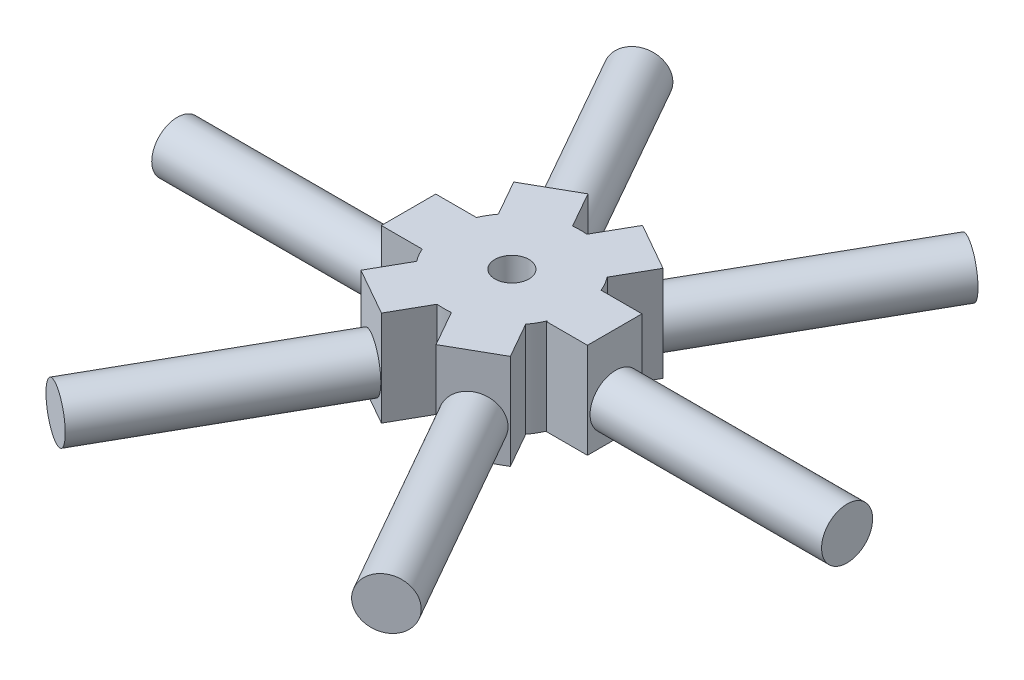
from build123d import *

# Parameters (mm, degrees)
SKETCH1_R                = 12.7
SKETCH1_R_2              = 3.175
BOSS_EXTRUDE1_DEPTH      = 22.86
SKETCH4_W                = 7.62
SKETCH4_H                = 10.16
BOSS_EXTRUDE2_DEPTH      = 22.86
CUT_EXTRUDE1_DEPTH       = 51.830375937
CUT_EXTRUDE1_DEPTH_BACK  = 51.830375937
SKETCH8_R                = 3
CUT_EXTRUDE2_DEPTH       = 54.699688086
CUT_EXTRUDE2_DEPTH_BACK  = 54.699688086
SKETCH9_R                = 3
CUT_EXTRUDE3_DEPTH       = 54.699688086
CUT_EXTRUDE3_DEPTH_BACK  = 54.699688086
SKETCH10_R               = 3
SKETCH12_R               = 23.401643017
CUT_EXTRUDE4_DEPTH       = 5.08
BOSS_EXTRUDE3_DEPTH      = 40.64
BOSS_EXTRUDE3_DEPTH_BACK = 2.54
SKETCH14_R               = 4.7625
BOSS_EXTRUDE4_DEPTH      = 40.64
BOSS_EXTRUDE4_DEPTH_BACK = 2.54
SKETCH15_R               = 4.7625
BOSS_EXTRUDE5_DEPTH      = 40.64
BOSS_EXTRUDE5_DEPTH_BACK = 2.54
SKETCH16_R               = 4.7625
BOSS_EXTRUDE6_DEPTH      = 40.64
BOSS_EXTRUDE6_DEPTH_BACK = 2.54
SKETCH17_R               = 4.7625
SKETCH18_R               = 4.7625
BOSS_EXTRUDE7_DEPTH      = 43.18
SKETCH19_R               = 4.7625
BOSS_EXTRUDE8_DEPTH      = 43.18


with BuildPart() as part:
    # Sketch1 → Boss-Extrude1 (new body)
    with BuildSketch(Plane(origin=(0, 0, 0), x_dir=(1, 0, 0), z_dir=(0, 1, 0))):
        with Locations(Location((0, 0, 0), (0, 0, 270))):
            Circle(SKETCH1_R)
        with Locations(Location((0, 0, 0), (0, 0, 270))):
            Circle(SKETCH1_R_2, mode=Mode.SUBTRACT)
    extrude(amount=BOSS_EXTRUDE1_DEPTH)

    # Sketch4 → Boss-Extrude2 (add)
    with BuildSketch(Plane(origin=(0, 0, 0), x_dir=(1, 0, 0), z_dir=(0, 1, 0))):
        with Locations((15.520261251, -0.164739944)):
            Rectangle(SKETCH4_W, SKETCH4_H)
        with Locations((-15.431900524, -0.040686304)):
            Rectangle(SKETCH4_W, SKETCH4_H)
        Polygon((-13.918276287, 14.248707215), (-10.16, 7.62), (-1.321723713, 12.63103505), (-5.08, 19.259742265), align=None)
        Polygon((5.105090281, 19.253106901), (1.338180271, 12.62930218), (10.169919899, 7.606755501), (13.936829909, 14.230560221), align=None)
        Polygon((-1.321723713, -12.63103505), (-10.16, -7.62), (-13.918276287, -14.248707215), (-5.08, -19.259742265), align=None)
        Polygon((10.169919899, -7.606755501), (1.338180271, -12.62930218), (5.105090281, -19.253106901), (13.936829909, -14.230560221), align=None)
    extrude(amount=BOSS_EXTRUDE2_DEPTH)

    # Sketch8 → Cut-Extrude1 (cut, two sides: drawn at the far end of the back side and taken through both)
    with BuildSketch(Plane.ZY.offset(21.781900524).offset(-CUT_EXTRUDE1_DEPTH_BACK)):
        with Locations((0, 11.43)):
            Circle(SKETCH8_R)
    extrude(amount=CUT_EXTRUDE1_DEPTH + CUT_EXTRUDE1_DEPTH_BACK, mode=Mode.SUBTRACT)

    # Sketch9 → Cut-Extrude2 (cut, two sides: drawn at the far end of the back side and taken through both)
    with BuildSketch(Plane(origin=(10.776596765, 0, -18.949768468), x_dir=(-0.8692657113802013, 0, -0.49434514564084964), z_dir=(0.49434514564084964, 0, -0.8692657113802013)).offset(-CUT_EXTRUDE2_DEPTH_BACK)):
        with Locations(Location((0, 11.43, 0), (0, 0, 180))):
            Circle(SKETCH9_R)
    extrude(amount=CUT_EXTRUDE2_DEPTH + CUT_EXTRUDE2_DEPTH_BACK, mode=Mode.SUBTRACT)

    # Sketch10 → Cut-Extrude3 (cut, two sides: drawn at the far end of the back side and taken through both)
    with BuildSketch(Plane(origin=(10.776596765, 0, 18.949768468), x_dir=(0.8692657113802004, 0, -0.494345145640851), z_dir=(0.494345145640851, 0, 0.8692657113802004)).offset(-CUT_EXTRUDE3_DEPTH_BACK)):
        with Locations((0, 11.43)):
            Circle(SKETCH10_R)
    extrude(amount=CUT_EXTRUDE3_DEPTH + CUT_EXTRUDE3_DEPTH_BACK, mode=Mode.SUBTRACT)

    # Sketch12 → Cut-Extrude4 (cut)
    with BuildSketch(Plane(origin=(0, 0, 0), x_dir=(1, 0, 0), z_dir=(0, 1, 0))):
        Circle(SKETCH12_R)
    extrude(amount=CUT_EXTRUDE4_DEPTH, mode=Mode.SUBTRACT)

    # Sketch14 → Boss-Extrude3 (add, two sides: drawn at the far end of the back side and taken through both)
    with BuildSketch(Plane(origin=(21.870261251, 0, 0), x_dir=(0, 0, -1), z_dir=(1, 0, 0)).offset(-BOSS_EXTRUDE3_DEPTH_BACK)):
        with Locations((0, 11.43)):
            Circle(SKETCH14_R)
    extrude(amount=BOSS_EXTRUDE3_DEPTH + BOSS_EXTRUDE3_DEPTH_BACK)

    # Sketch15 → Boss-Extrude4 (add, two sides: drawn at the far end of the back side and taken through both)
    with BuildSketch(Plane(origin=(10.776596765, 0, 18.949768468), x_dir=(0.8692657113802004, 0, -0.494345145640851), z_dir=(0.494345145640851, 0, 0.8692657113802004)).offset(-BOSS_EXTRUDE4_DEPTH_BACK)):
        with Locations((0, 11.43)):
            Circle(SKETCH15_R)
    extrude(amount=BOSS_EXTRUDE4_DEPTH + BOSS_EXTRUDE4_DEPTH_BACK)

    # Sketch16 → Boss-Extrude5 (add, two sides: drawn at the far end of the back side and taken through both)
    with BuildSketch(Plane.ZY.offset(21.781900524).offset(-BOSS_EXTRUDE5_DEPTH_BACK)):
        with Locations(Location((0, 11.43, 0), (0, 0, 180))):
            Circle(SKETCH16_R)
    extrude(amount=BOSS_EXTRUDE5_DEPTH + BOSS_EXTRUDE5_DEPTH_BACK)

    # Sketch17 → Boss-Extrude6 (add, two sides: drawn at the far end of the back side and taken through both)
    with BuildSketch(Plane(origin=(10.776596765, 0, -18.949768468), x_dir=(-0.8692657113802013, 0, -0.49434514564084964), z_dir=(0.49434514564084964, 0, -0.8692657113802013)).offset(-BOSS_EXTRUDE6_DEPTH_BACK)):
        with Locations((0, 11.43)):
            Circle(SKETCH17_R)
    extrude(amount=BOSS_EXTRUDE6_DEPTH + BOSS_EXTRUDE6_DEPTH_BACK)

    # Sketch18 → Boss-Extrude7 (add)
    with BuildSketch(Plane(origin=(-9.499138144, 0, -16.75422474), x_dir=(-0.8699090833946802, 0, 0.4932121111929708), z_dir=(-0.4932121111929708, 0, -0.8699090833946802))):
        with Locations((0, 11.43)):
            Circle(SKETCH18_R)
    extrude(amount=BOSS_EXTRUDE7_DEPTH)

    # Sketch19 → Boss-Extrude8 (add)
    with BuildSketch(Plane(origin=(-9.499138144, 0, 16.75422474), x_dir=(0.8699090833947006, 0, 0.4932121111929346), z_dir=(-0.4932121111929346, 0, 0.8699090833947006))):
        with Locations((0, 11.43)):
            Circle(SKETCH19_R)
    extrude(amount=BOSS_EXTRUDE8_DEPTH)


solid = part.part
